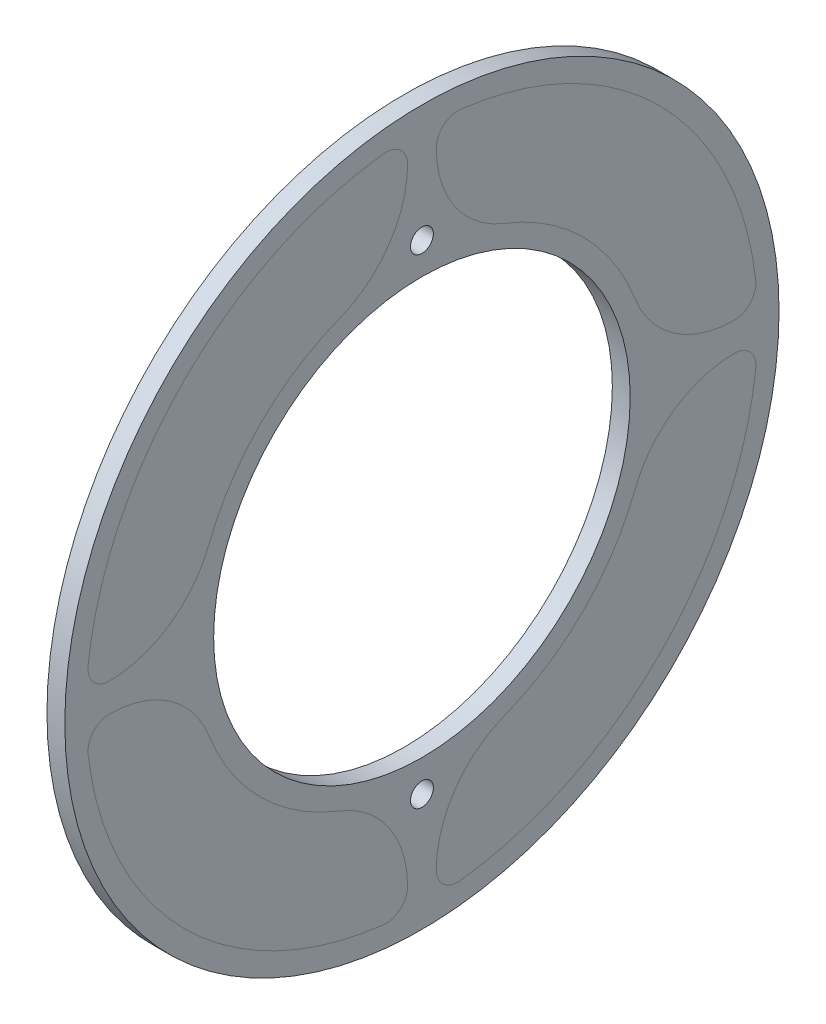
from build123d import *

# Parameters (mm, degrees)
SKETCH1_R             = 50
SKETCH1_R_2           = 29.16
SKETCH1_R_3           = 1.6
BOSS_EXTRUDE1_DEPTH   = 2.5
CUT_EXTRUDE1_DEPTH    = 21.84
FILLET1_R             = 3
BOSS_EXTRUDE2_DEPTH   = 2.5
BOSS_EXTRUDE2_2_DEPTH = 2.5
BOSS_EXTRUDE2_3_DEPTH = 2.5
BOSS_EXTRUDE2_4_DEPTH = 2.5


with BuildPart() as part:
    # Sketch1 → Boss-Extrude1 (new body)
    with BuildSketch(Plane(origin=(0, 0, 0), x_dir=(0, 0, -1), z_dir=(1, 0, 0))):
        Circle(SKETCH1_R)
        Circle(SKETCH1_R_2, mode=Mode.SUBTRACT)
        with Locations((0, 33.58)):
            Circle(SKETCH1_R_3, mode=Mode.SUBTRACT)
        with Locations((0, -33.58)):
            Circle(SKETCH1_R_3, mode=Mode.SUBTRACT)
    extrude(amount=BOSS_EXTRUDE1_DEPTH)

    # Sketch2 → Cut-Extrude1 (cut)
    with BuildSketch(Plane(origin=(2.5, 0, 0), x_dir=(0, 0, -1), z_dir=(1, 0, 0))):
        with BuildLine():
            Line((43.8178046, 2), (47, 2))
            ThreePointArc((47, 2), (33.264094757, 33.264094757), (2, 47))
            Line((2, 47), (2, 43.8178046))
            ThreePointArc((2, 43.8178046), (4.622945045, 35.343814357), (11.574468085, 29.833398877))
            ThreePointArc((11.574468085, 29.833398877), (22.627416998, 22.627416998), (29.833398877, 11.574468085))
            ThreePointArc((29.833398877, 11.574468085), (35.343814357, 4.622945045), (43.8178046, 2))
        make_face()
        with BuildLine():
            Line((43.8178046, -2), (47, -2))
            ThreePointArc((47, -2), (33.264094757, -33.264094757), (2, -47))
            Line((2, -47), (2, -43.8178046))
            ThreePointArc((2, -43.8178046), (4.622945045, -35.343814357), (11.574468085, -29.833398877))
            ThreePointArc((11.574468085, -29.833398877), (22.627416998, -22.627416998), (29.833398877, -11.574468085))
            ThreePointArc((29.833398877, -11.574468085), (35.343814357, -4.622945045), (43.8178046, -2))
        make_face()
        with BuildLine():
            Line((-2, -43.8178046), (-2, -47))
            ThreePointArc((-2, -47), (-33.264094757, -33.264094757), (-47, -2))
            Line((-47, -2), (-43.8178046, -2))
            ThreePointArc((-43.8178046, -2), (-35.343814357, -4.622945045), (-29.833398877, -11.574468085))
            ThreePointArc((-29.833398877, -11.574468085), (-22.627416998, -22.627416998), (-11.574468085, -29.833398877))
            ThreePointArc((-11.574468085, -29.833398877), (-4.622945045, -35.343814357), (-2, -43.8178046))
        make_face()
        with BuildLine():
            Line((-43.8178046, 2), (-47, 2))
            ThreePointArc((-47, 2), (-33.264094757, 33.264094757), (-2, 47))
            Line((-2, 47), (-2, 43.8178046))
            ThreePointArc((-2, 43.8178046), (-4.622945045, 35.343814357), (-11.574468085, 29.833398877))
            ThreePointArc((-11.574468085, 29.833398877), (-22.627416998, 22.627416998), (-29.833398877, 11.574468085))
            ThreePointArc((-29.833398877, 11.574468085), (-35.343814357, 4.622945045), (-43.8178046, 2))
        make_face()
    extrude(amount=-CUT_EXTRUDE1_DEPTH, mode=Mode.SUBTRACT)

    # Fillet1
    fillet1_edges = [part.edges().sort_by_distance(p)[0] for p in [
        (1.25, 2, 47),
        (1.25, -2, 47),
        (1.25, -47, 2),
        (1.25, -47, -2),
        (1.25, -2, -47),
        (1.25, 2, -47),
        (1.25, 47, -2),
        (1.25, 47, 2),
    ]]
    fillet(fillet1_edges, radius=FILLET1_R)


with BuildPart() as body_2:
    # Sketch3 → Boss-Extrude2 (new body)
    with BuildSketch(Plane(origin=(2.5, 0, 0), x_dir=(0, 0, -1), z_dir=(1, 0, 0))):
        with BuildLine():
            ThreePointArc((29.833398877, 11.574468085), (35.312885349, 4.644177546), (43.742773629, 2.000187656))
            ThreePointArc((43.742773629, 2.000187656), (45.991278195, 2.997280927), (46.738383519, 5.34074021))
            ThreePointArc((46.738383519, 5.34074021), (33.264094757, 33.264094757), (5.34074021, 46.738383519))
            ThreePointArc((5.34074021, 46.738383519), (2.997280927, 45.991278195), (2.000187656, 43.742773629))
            ThreePointArc((2.000187656, 43.742773629), (4.644177546, 35.312885349), (11.574468085, 29.833398877))
            ThreePointArc((11.574468085, 29.833398877), (22.627416998, 22.627416998), (29.833398877, 11.574468085))
        make_face()
    extrude(amount=-BOSS_EXTRUDE2_DEPTH)


with BuildPart() as body_3:
    # Sketch3 → Boss-Extrude2 2 (new body)
    with BuildSketch(Plane(origin=(2.5, 0, 0), x_dir=(0, 0, -1), z_dir=(1, 0, 0))):
        with BuildLine():
            ThreePointArc((11.574468085, -29.833398877), (4.644177546, -35.312885349), (2.000187656, -43.742773629))
            ThreePointArc((2.000187656, -43.742773629), (2.997280927, -45.991278195), (5.34074021, -46.738383519))
            ThreePointArc((5.34074021, -46.738383519), (33.264094757, -33.264094757), (46.738383519, -5.34074021))
            ThreePointArc((46.738383519, -5.34074021), (45.991278195, -2.997280927), (43.742773629, -2.000187656))
            ThreePointArc((43.742773629, -2.000187656), (35.312885349, -4.644177546), (29.833398877, -11.574468085))
            ThreePointArc((29.833398877, -11.574468085), (22.627416998, -22.627416998), (11.574468085, -29.833398877))
        make_face()
    extrude(amount=-BOSS_EXTRUDE2_2_DEPTH)


with BuildPart() as body_4:
    # Sketch3 → Boss-Extrude2 3 (new body)
    with BuildSketch(Plane(origin=(2.5, 0, 0), x_dir=(0, 0, -1), z_dir=(1, 0, 0))):
        with BuildLine():
            ThreePointArc((-29.833398877, -11.574468085), (-35.312885349, -4.644177546), (-43.742773629, -2.000187656))
            ThreePointArc((-43.742773629, -2.000187656), (-45.991278195, -2.997280927), (-46.738383519, -5.34074021))
            ThreePointArc((-46.738383519, -5.34074021), (-33.264094757, -33.264094757), (-5.34074021, -46.738383519))
            ThreePointArc((-5.34074021, -46.738383519), (-2.997280927, -45.991278195), (-2.000187656, -43.742773629))
            ThreePointArc((-2.000187656, -43.742773629), (-4.644177546, -35.312885349), (-11.574468085, -29.833398877))
            ThreePointArc((-11.574468085, -29.833398877), (-22.627416998, -22.627416998), (-29.833398877, -11.574468085))
        make_face()
    extrude(amount=-BOSS_EXTRUDE2_3_DEPTH)


with BuildPart() as body_5:
    # Sketch3 → Boss-Extrude2 4 (new body)
    with BuildSketch(Plane(origin=(2.5, 0, 0), x_dir=(0, 0, -1), z_dir=(1, 0, 0))):
        with BuildLine():
            ThreePointArc((-11.574468085, 29.833398877), (-4.644177546, 35.312885349), (-2.000187656, 43.742773629))
            ThreePointArc((-2.000187656, 43.742773629), (-2.997280927, 45.991278195), (-5.34074021, 46.738383519))
            ThreePointArc((-5.34074021, 46.738383519), (-33.264094757, 33.264094757), (-46.738383519, 5.34074021))
            ThreePointArc((-46.738383519, 5.34074021), (-45.991278195, 2.997280927), (-43.742773629, 2.000187656))
            ThreePointArc((-43.742773629, 2.000187656), (-35.312885349, 4.644177546), (-29.833398877, 11.574468085))
            ThreePointArc((-29.833398877, 11.574468085), (-22.627416998, 22.627416998), (-11.574468085, 29.833398877))
        make_face()
    extrude(amount=-BOSS_EXTRUDE2_4_DEPTH)


solid = Compound([part.part, body_2.part, body_3.part, body_4.part, body_5.part])
